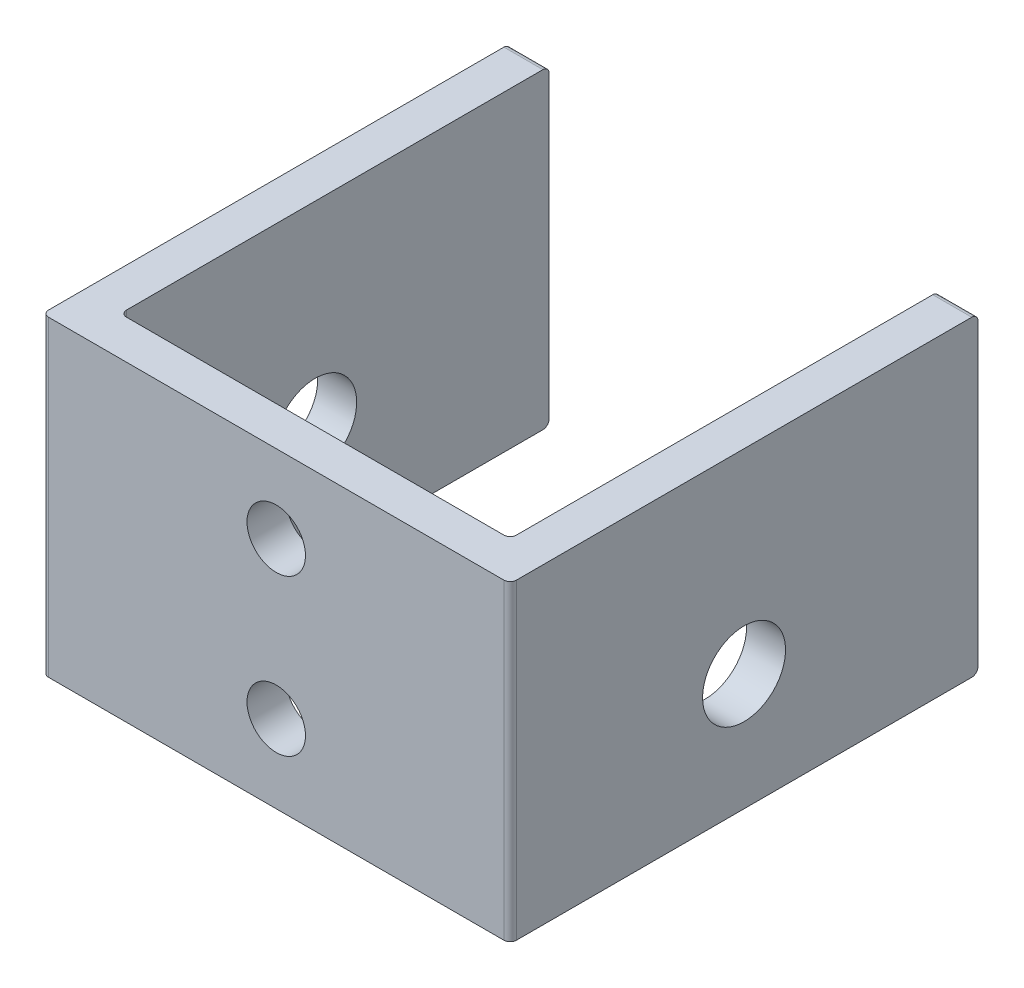
from build123d import *

# Parameters (mm, degrees)
BOSS_EXTRUDE1_DEPTH            = 25.4
F_1_4_CLEARANCE_HOLE1_D        = 6.7564
F_3_16_0_1875_DIAMETER_HOLE1_D = 4.7625
FILLET1_R                      = 0.508


with BuildPart() as part:
    # Sketch1 → Boss-Extrude1 (new body)
    with BuildSketch(Plane(origin=(0, 0, 0), x_dir=(1, 0, 0), z_dir=(0, 1, 0))):
        Polygon((-15.875, 19.05), (-15.875, -15.875), (15.875, -15.875), (15.875, 19.05), (19.05, 19.05), (19.05, -19.05), (-19.05, -19.05), (-19.05, 19.05), align=None)
    extrude(amount=BOSS_EXTRUDE1_DEPTH)

    # 1/4 Clearance Hole1 (through all)
    with Locations(Plane(origin=(-19.05, 0, 0), x_dir=(0, 0, -1), z_dir=(-1, 0, 0))):
        with Locations((-0.00254, -9.525)):
            Hole(F_1_4_CLEARANCE_HOLE1_D / 2)

    # 3/16 (0.1875) Diameter Hole1 (through all)
    with Locations(Plane(origin=(0, 0, 15.875), x_dir=(-1, 0, 0), z_dir=(0, 0, -1))):
        with Locations((0, 6.35), (0, 19.05)):
            Hole(F_3_16_0_1875_DIAMETER_HOLE1_D / 2)

    # Fillet1
    fillet1_edges = [part.edges().sort_by_distance(p)[0] for p in [
        (17.4625, 0, -19.05),
        (19.05, 12.7, 19.05),
        (-19.05, 12.7, 19.05),
        (-15.875, 12.7, 15.875),
        (15.875, 12.7, 15.875),
        (-17.4625, 25.4, -19.05),
        (17.4625, 25.4, -19.05),
        (-17.4625, 0, -19.05),
    ]]
    fillet(fillet1_edges, radius=FILLET1_R)


solid = part.part
